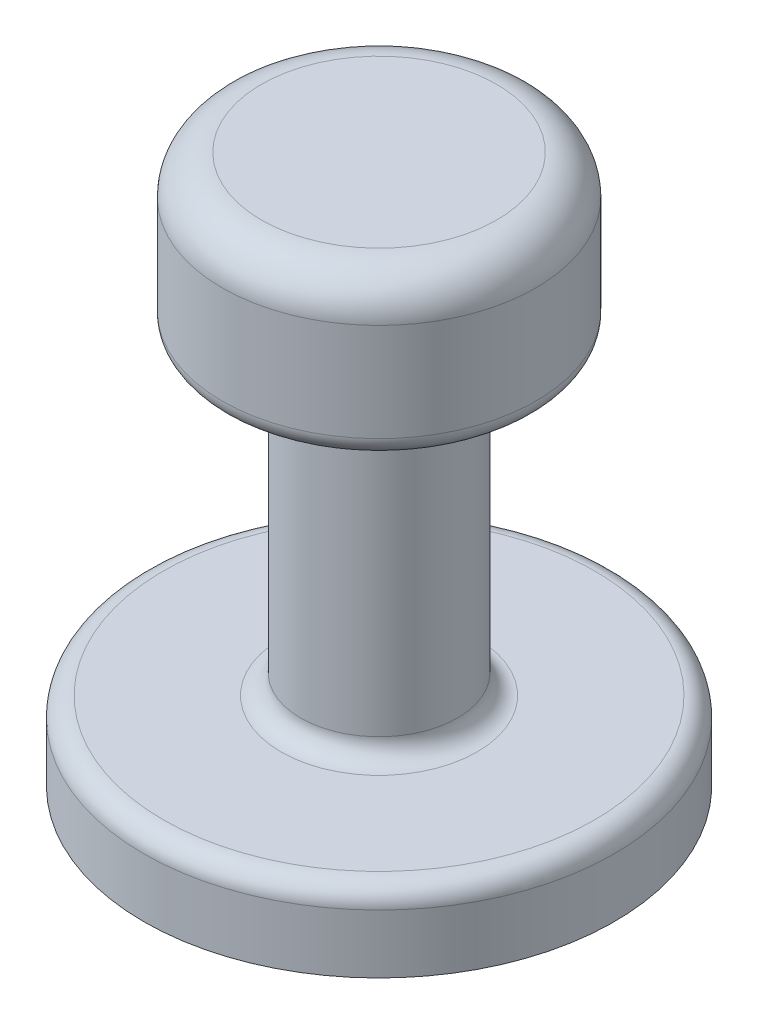
from build123d import *

# Parameters (mm, degrees)
SKETCH1_R           = 2
BOSS_EXTRUDE1_DEPTH = 7
SKETCH1_5_R         = 2
SKETCH1_5_R_2       = 1
CUT_EXTRUDE2_DEPTH  = 5
SKETCH1_6_R         = 3
SKETCH1_6_R_2       = 1
BOSS_EXTRUDE3_DEPTH = 1
FILLET2_R           = 0.5
FILLET3_R           = 0.25
FILLET4_R           = 0.25
FILLET5_R           = 0.25


with BuildPart() as part:
    # Sketch1 → Boss-Extrude1 (new body)
    with BuildSketch(Plane(origin=(0, 0, 0), x_dir=(1, 0, 0), z_dir=(0, 1, 0))):
        Circle(SKETCH1_R)
    extrude(amount=BOSS_EXTRUDE1_DEPTH)

    # Sketch1<5> → Cut-Extrude2 (cut)
    with BuildSketch(Plane(origin=(0, 0, 0), x_dir=(1, 0, 0), z_dir=(0, 1, 0))):
        Circle(SKETCH1_5_R)
        Circle(SKETCH1_5_R_2, mode=Mode.SUBTRACT)
    extrude(amount=CUT_EXTRUDE2_DEPTH, mode=Mode.SUBTRACT)

    # Sketch1<6> → Boss-Extrude3 (add)
    with BuildSketch(Plane(origin=(0, 0, 0), x_dir=(1, 0, 0), z_dir=(0, 1, 0))):
        Circle(SKETCH1_6_R)
        Circle(SKETCH1_6_R_2, mode=Mode.SUBTRACT)
    extrude(amount=BOSS_EXTRUDE3_DEPTH)

    # Fillet2
    fillet2_edges = [part.edges().sort_by_distance(p)[0] for p in [
        (-2, 7, 0),
    ]]
    fillet(fillet2_edges, radius=FILLET2_R)

    # Fillet3
    fillet3_edges = [part.edges().sort_by_distance(p)[0] for p in [
        (-3, 1, 0),
    ]]
    fillet(fillet3_edges, radius=FILLET3_R)

    # Fillet4
    fillet4_edges = [part.edges().sort_by_distance(p)[0] for p in [
        (-2, 5, 0),
        (-1, 5, 0),
    ]]
    fillet(fillet4_edges, radius=FILLET4_R)

    # Fillet5
    fillet5_edges = [part.edges().sort_by_distance(p)[0] for p in [
        (-1, 1, 0),
    ]]
    fillet(fillet5_edges, radius=FILLET5_R)


solid = part.part
